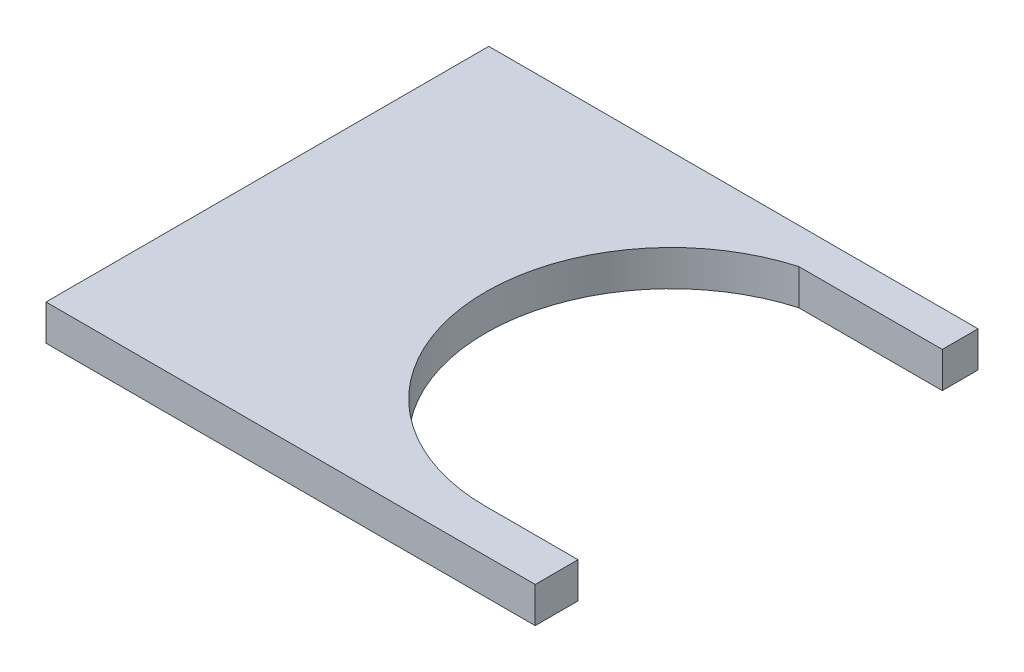
from build123d import *

# Parameters (mm, degrees)
BOSS_EXTRUDE1_DEPTH = 10
SKETCH2_W           = 40.182856857
SKETCH2_H           = 10
BOSS_EXTRUDE2_DEPTH = 10


with BuildPart() as part:
    # Sketch1 → Boss-Extrude1 (new body)
    with BuildSketch(Plane(origin=(0, 0, 0), x_dir=(1, 0, 0), z_dir=(0, 1, 0))):
        with BuildLine():
            Line((137, 124), (0, 124))
            Line((0, 124), (0, 0))
            Line((0, 0), (137, 0))
            Line((137, 0), (137, 12))
            Line((137, 12), (111.1, 12))
            ThreePointArc((111.1, 12), (59.1, 64), (111.1, 116))
            Line((111.1, 116), (137, 116))
            Line((137, 116), (137, 124))
        make_face()
    extrude(amount=BOSS_EXTRUDE1_DEPTH)

    # Sketch2 → Boss-Extrude2 (add)
    with BuildSketch(Plane(origin=(0, 10, 0), x_dir=(1, 0, 0), z_dir=(0, 1, 0))):
        with Locations((116.908571572, 119)):
            Rectangle(SKETCH2_W, SKETCH2_H)
    extrude(amount=-BOSS_EXTRUDE2_DEPTH)


solid = part.part
